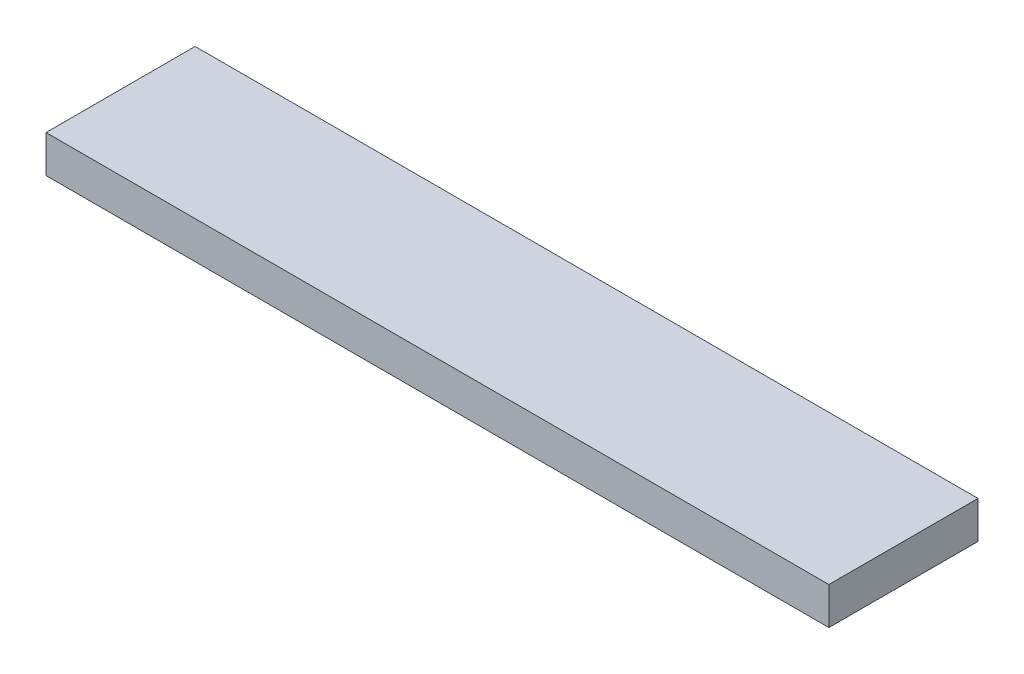
from build123d import *

# Parameters (mm, degrees)
SKETCH1_W           = 133.35
SKETCH1_H           = 25.4
BOSS_EXTRUDE1_DEPTH = 6.35


with BuildPart() as part:
    # Sketch1 → Boss-Extrude1 (new body)
    with BuildSketch(Plane(origin=(0, 0, 0), x_dir=(1, 0, 0), z_dir=(0, 1, 0))):
        Rectangle(SKETCH1_W, SKETCH1_H)
    extrude(amount=BOSS_EXTRUDE1_DEPTH)


solid = part.part
